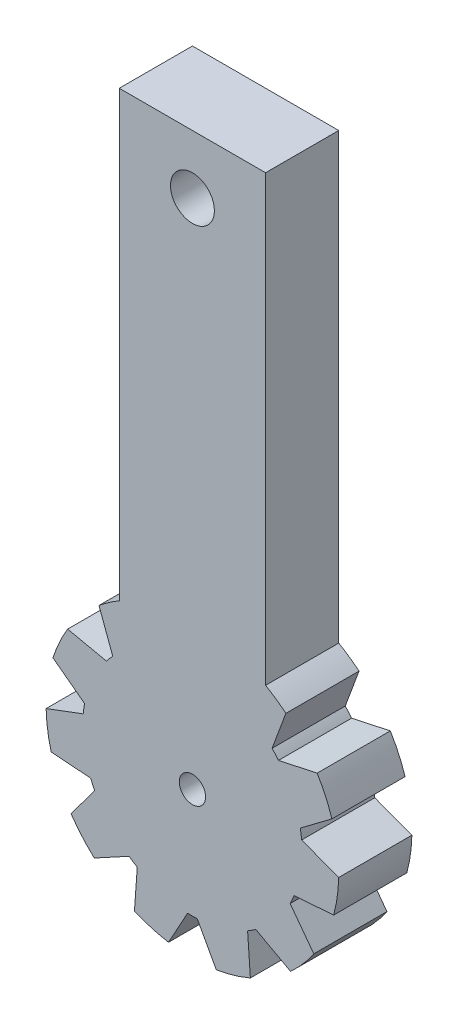
from build123d import *

# Parameters (mm, degrees)
BOSS_EXTRUDE1_DEPTH = 5
SKETCH5_R           = 2.425
CUT_EXTRUDE2_DEPTH  = 2.7
SKETCH6_R           = 0.9
CUT_EXTRUDE3_DEPTH  = 12
SKETCH7_W           = 10
SKETCH7_H           = 35
BOSS_EXTRUDE3_DEPTH = 5
SKETCH8_R           = 1.5
CUT_EXTRUDE4_DEPTH  = 12


with BuildPart() as part:
    # Sketch1 → Boss-Extrude1 (new body)
    with BuildSketch(Plane.XY):
        with BuildLine():
            Line((-1.212917817, 9.926168967), (-1.792316692, 7.28269187))
            ThreePointArc((-1.792316692, 7.28269187), (-2.112994176, 7.196197302), (-2.429527737, 7.095589826))
            Line((-2.429527737, 7.095589826), (-4.346120706, 9.006177592))
            ThreePointArc((-4.346120706, 9.006177592), (-5.406408175, 8.412535328), (-6.386863504, 7.694671831))
            Line((-6.386863504, 7.694671831), (-5.445113235, 5.157590703))
            ThreePointArc((-5.445113235, 5.157590703), (-5.668121808, 4.911455505), (-5.880014276, 4.655688147))
            Line((-5.880014276, 4.655688147), (-8.525296613, 5.226788465))
            ThreePointArc((-8.525296613, 5.226788465), (-9.096319954, 4.15415013), (-9.533025155, 3.020170756))
            Line((-9.533025155, 3.020170756), (-7.369124799, 1.394990929))
            ThreePointArc((-7.369124799, 1.394990929), (-7.423660814, 1.067361287), (-7.463637828, 0.737638377))
            Line((-7.463637828, 0.737638377), (-9.997751083, -0.212069068))
            ThreePointArc((-9.997751083, -0.212069068), (-9.898214419, -1.423148383), (-9.652518677, -2.613213194))
            Line((-9.652518677, -2.613213194), (-6.953491308, -2.810508608))
            ThreePointArc((-6.953491308, -2.810508608), (-6.822239965, -3.115612598), (-6.677609105, -3.414606366))
            Line((-6.677609105, -3.414606366), (-8.295990224, -5.583596171))
            ThreePointArc((-8.295990224, -5.583596171), (-7.557495744, -6.548607339), (-6.70740572, -7.416920419))
            Line((-6.70740572, -7.416920419), (-4.330173457, -6.12369152))
            ThreePointArc((-4.330173457, -6.12369152), (-4.054806131, -6.309401496), (-3.771486674, -6.482737714))
            Line((-3.771486674, -6.482737714), (-3.960311086, -9.182370941))
            ThreePointArc((-3.960311086, -9.182370941), (-2.817325568, -9.594929736), (-1.63273884, -9.865807817))
            Line((-1.63273884, -9.865807817), (-0.332056129, -7.492645643))
            ThreePointArc((-0.332056129, -7.492645643), (0, -7.5), (0.332056129, -7.492645643))
            Line((0.332056129, -7.492645643), (1.63273884, -9.865807817))
            ThreePointArc((1.63273884, -9.865807817), (2.817325568, -9.594929736), (3.960311086, -9.182370941))
            Line((3.960311086, -9.182370941), (3.771486674, -6.482737714))
            ThreePointArc((3.771486674, -6.482737714), (4.054806131, -6.309401496), (4.330173457, -6.12369152))
            Line((4.330173457, -6.12369152), (6.70740572, -7.416920419))
            ThreePointArc((6.70740572, -7.416920419), (7.557495744, -6.548607339), (8.295990224, -5.583596171))
            Line((8.295990224, -5.583596171), (6.677609105, -3.414606366))
            ThreePointArc((6.677609105, -3.414606366), (6.822239965, -3.115612598), (6.953491308, -2.810508608))
            Line((6.953491308, -2.810508608), (9.652518677, -2.613213194))
            ThreePointArc((9.652518677, -2.613213194), (9.898214419, -1.423148383), (9.997751083, -0.212069068))
            Line((9.997751083, -0.212069068), (7.463637828, 0.737638377))
            ThreePointArc((7.463637828, 0.737638377), (7.423660814, 1.067361287), (7.369124799, 1.394990929))
            Line((7.369124799, 1.394990929), (9.533025155, 3.020170756))
            ThreePointArc((9.533025155, 3.020170756), (9.096319954, 4.15415013), (8.525296613, 5.226788465))
            Line((8.525296613, 5.226788465), (5.880014276, 4.655688147))
            ThreePointArc((5.880014276, 4.655688147), (5.668121808, 4.911455505), (5.445113235, 5.157590703))
            Line((5.445113235, 5.157590703), (6.386863504, 7.694671831))
            ThreePointArc((6.386863504, 7.694671831), (5.406408175, 8.412535328), (4.346120706, 9.006177592))
            Line((4.346120706, 9.006177592), (2.429527737, 7.095589826))
            ThreePointArc((2.429527737, 7.095589826), (2.112994176, 7.196197302), (1.792316692, 7.28269187))
            Line((1.792316692, 7.28269187), (1.212917817, 9.926168967))
            ThreePointArc((1.212917817, 9.926168967), (0, 10), (-1.212917817, 9.926168967))
        make_face()
    extrude(amount=BOSS_EXTRUDE1_DEPTH)

    # Sketch5 → Cut-Extrude2 (cut)
    with BuildSketch(Plane(origin=(0, 0, 0), x_dir=(-1, 0, 0), z_dir=(0, 0, -1))):
        Circle(SKETCH5_R)
    extrude(amount=-CUT_EXTRUDE2_DEPTH, mode=Mode.SUBTRACT)

    # Sketch6 → Cut-Extrude3 (cut)
    with BuildSketch(Plane(origin=(0, 0, 2.7), x_dir=(-1, 0, 0), z_dir=(0, 0, -1))):
        Circle(SKETCH6_R)
    extrude(amount=-CUT_EXTRUDE3_DEPTH, mode=Mode.SUBTRACT)

    # Sketch7 → Boss-Extrude3 (add)
    with BuildSketch(Plane(origin=(0, 0, 0), x_dir=(-1, 0, 0), z_dir=(0, 0, -1))):
        with Locations((0, 21.5)):
            Rectangle(SKETCH7_W, SKETCH7_H)
    extrude(amount=-BOSS_EXTRUDE3_DEPTH)

    # Sketch8 → Cut-Extrude4 (cut)
    with BuildSketch(Plane(origin=(0, 0, 0), x_dir=(-1, 0, 0), z_dir=(0, 0, -1))):
        with Locations((0, 35)):
            Circle(SKETCH8_R)
    extrude(amount=-CUT_EXTRUDE4_DEPTH, mode=Mode.SUBTRACT)


solid = part.part
